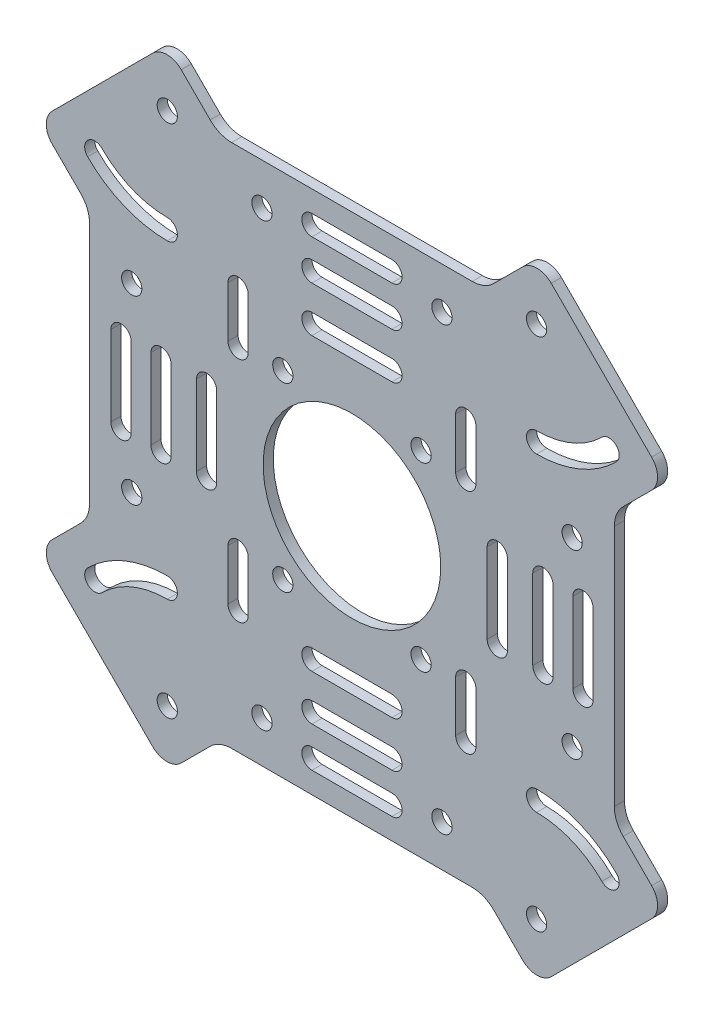
from build123d import *

# Parameters (mm, degrees)
CROQUIS1_R              = 2
CROQUIS1_R_2            = 17.550664292
SALIENTE_EXTRUIR1_DEPTH = 2


with BuildPart() as part:
    # Croquis1 → Saliente-Extruir1 (new body)
    with BuildSketch(Plane.XY):
        with BuildLine():
            Line((3840.792774936, 1034.197893978), (3840.792774936, 1058.17592135))
            ThreePointArc((3840.792774936, 1058.17592135), (3841.249497741, 1060.472021944), (3842.550134249, 1062.418562037))
            Line((3842.550134249, 1062.418562037), (3848.170692747, 1068.039120535))
            ThreePointArc((3848.170692747, 1068.039120535), (3849.342265622, 1070.867547659), (3848.170692747, 1073.695974784))
            Line((3848.170692747, 1073.695974784), (3828.337191902, 1093.529475628))
            ThreePointArc((3828.337191902, 1093.529475628), (3825.508764778, 1094.701048503), (3822.680337653, 1093.529475628))
            Line((3822.680337653, 1093.529475628), (3816.956115316, 1087.805253291))
            ThreePointArc((3816.956115316, 1087.805253291), (3815.009575223, 1086.504616783), (3812.713474628, 1086.047893978))
            Line((3812.713474628, 1086.047893978), (3788.942774936, 1086.047893978))
            Line((3788.942774936, 1086.047893978), (3765.172075243, 1086.047893978))
            ThreePointArc((3765.172075243, 1086.047893978), (3762.875974649, 1086.504616783), (3760.929434556, 1087.805253291))
            Line((3760.929434556, 1087.805253291), (3755.205212219, 1093.529475628))
            ThreePointArc((3755.205212219, 1093.529475628), (3752.376785094, 1094.701048503), (3749.548357969, 1093.529475628))
            Line((3749.548357969, 1093.529475628), (3729.714857125, 1073.695974784))
            ThreePointArc((3729.714857125, 1073.695974784), (3728.54328425, 1070.867547659), (3729.714857125, 1068.039120535))
            Line((3729.714857125, 1068.039120535), (3735.335415623, 1062.418562037))
            ThreePointArc((3735.335415623, 1062.418562037), (3736.636052131, 1060.472021944), (3737.092774936, 1058.17592135))
            Line((3737.092774936, 1058.17592135), (3737.092774936, 1034.197893978))
            Line((3737.092774936, 1034.197893978), (3737.092774936, 1010.219866606))
            ThreePointArc((3737.092774936, 1010.219866606), (3736.636052131, 1007.923766012), (3735.335415623, 1005.977225919))
            Line((3735.335415623, 1005.977225919), (3729.714857125, 1000.356667421))
            ThreePointArc((3729.714857125, 1000.356667421), (3728.54328425, 997.528240297), (3729.714857125, 994.699813172))
            Line((3729.714857125, 994.699813172), (3749.548357969, 974.866312328))
            ThreePointArc((3749.548357969, 974.866312328), (3752.376785094, 973.694739453), (3755.205212219, 974.866312328))
            Line((3755.205212219, 974.866312328), (3760.929434556, 980.590534665))
            ThreePointArc((3760.929434556, 980.590534665), (3762.875974649, 981.891171173), (3765.172075243, 982.347893978))
            Line((3765.172075243, 982.347893978), (3788.942774936, 982.347893978))
            Line((3788.942774936, 982.347893978), (3812.713474628, 982.347893978))
            ThreePointArc((3812.713474628, 982.347893978), (3815.009575223, 981.891171173), (3816.956115316, 980.590534665))
            Line((3816.956115316, 980.590534665), (3822.680337653, 974.866312328))
            ThreePointArc((3822.680337653, 974.866312328), (3825.508764778, 973.694739453), (3828.337191902, 974.866312328))
            Line((3828.337191902, 974.866312328), (3848.170692747, 994.699813172))
            ThreePointArc((3848.170692747, 994.699813172), (3849.342265622, 997.528240297), (3848.170692747, 1000.356667421))
            Line((3848.170692747, 1000.356667421), (3842.550134249, 1005.977225919))
            ThreePointArc((3842.550134249, 1005.977225919), (3841.249497741, 1007.923766012), (3840.792774936, 1010.219866606))
            Line((3840.792774936, 1010.219866606), (3840.792774936, 1034.197893978))
        make_face()
        with Locations((3825.435609484, 1085.117349548)):
            Circle(CROQUIS1_R, mode=Mode.SUBTRACT)
        with Locations((3771.158067563, 1077.82024622)):
            Circle(CROQUIS1_R, mode=Mode.SUBTRACT)
        with Locations((3752.449940388, 1085.117349548)):
            Circle(CROQUIS1_R, mode=Mode.SUBTRACT)
        with Locations((3825.435609484, 983.278438408)):
            Circle(CROQUIS1_R, mode=Mode.SUBTRACT)
        with Locations((3752.449940388, 983.278438408)):
            Circle(CROQUIS1_R, mode=Mode.SUBTRACT)
        with Locations((3806.727482309, 1077.82024622)):
            Circle(CROQUIS1_R, mode=Mode.SUBTRACT)
        with Locations((3771.158067563, 990.575541736)):
            Circle(CROQUIS1_R, mode=Mode.SUBTRACT)
        with Locations((3806.727482309, 990.575541736)):
            Circle(CROQUIS1_R, mode=Mode.SUBTRACT)
        with Locations((3745.424086533, 1052.086265191)):
            Circle(CROQUIS1_R, mode=Mode.SUBTRACT)
        with Locations((3832.461463339, 1052.086265191)):
            Circle(CROQUIS1_R, mode=Mode.SUBTRACT)
        with Locations((3745.424086533, 1016.309522765)):
            Circle(CROQUIS1_R, mode=Mode.SUBTRACT)
        with Locations((3832.461463339, 1016.309522765)):
            Circle(CROQUIS1_R, mode=Mode.SUBTRACT)
        with Locations((3788.942774936, 1034.028366495)):
            Circle(CROQUIS1_R_2, mode=Mode.SUBTRACT)
        with Locations((3775.282861576, 1052.086265191)):
            Circle(CROQUIS1_R, mode=Mode.SUBTRACT)
        with Locations((3802.602688295, 1052.086265191)):
            Circle(CROQUIS1_R, mode=Mode.SUBTRACT)
        with Locations((3775.282861576, 1016.309522765)):
            Circle(CROQUIS1_R, mode=Mode.SUBTRACT)
        with Locations((3802.602688295, 1016.309522765)):
            Circle(CROQUIS1_R, mode=Mode.SUBTRACT)
        with BuildLine():
            Line((3809.442774936, 1051.697893978), (3809.442774936, 1061.697893978))
            ThreePointArc((3809.442774936, 1061.697893978), (3811.442774936, 1063.697893978), (3813.442774936, 1061.697893978))
            Line((3813.442774936, 1061.697893978), (3813.442774936, 1051.697893978))
            ThreePointArc((3813.442774936, 1051.697893978), (3811.442774936, 1049.697893978), (3809.442774936, 1051.697893978))
        make_face(mode=Mode.SUBTRACT)
        with BuildLine():
            Line((3764.442774936, 1051.697893978), (3764.442774936, 1061.697893978))
            ThreePointArc((3764.442774936, 1061.697893978), (3766.442774936, 1063.697893978), (3768.442774936, 1061.697893978))
            Line((3768.442774936, 1061.697893978), (3768.442774936, 1051.697893978))
            ThreePointArc((3768.442774936, 1051.697893978), (3766.442774936, 1049.697893978), (3764.442774936, 1051.697893978))
        make_face(mode=Mode.SUBTRACT)
        with BuildLine():
            Line((3764.442774936, 1006.697893978), (3764.442774936, 1016.697893978))
            ThreePointArc((3764.442774936, 1016.697893978), (3766.442774936, 1018.697893978), (3768.442774936, 1016.697893978))
            Line((3768.442774936, 1016.697893978), (3768.442774936, 1006.697893978))
            ThreePointArc((3768.442774936, 1006.697893978), (3766.442774936, 1004.697893978), (3764.442774936, 1006.697893978))
        make_face(mode=Mode.SUBTRACT)
        with BuildLine():
            Line((3809.442774936, 1006.697893978), (3809.442774936, 1016.697893978))
            ThreePointArc((3809.442774936, 1016.697893978), (3811.442774936, 1018.697893978), (3813.442774936, 1016.697893978))
            Line((3813.442774936, 1016.697893978), (3813.442774936, 1006.697893978))
            ThreePointArc((3813.442774936, 1006.697893978), (3811.442774936, 1004.697893978), (3809.442774936, 1006.697893978))
        make_face(mode=Mode.SUBTRACT)
        with BuildLine():
            Line((3832.59149284, 1026.291938739), (3832.59149284, 1042.103849217))
            ThreePointArc((3832.59149284, 1042.103849217), (3834.59149284, 1044.103849217), (3836.59149284, 1042.103849217))
            Line((3836.59149284, 1042.103849217), (3836.59149284, 1026.291938739))
            ThreePointArc((3836.59149284, 1026.291938739), (3834.59149284, 1024.291938739), (3832.59149284, 1026.291938739))
        make_face(mode=Mode.SUBTRACT)
        with BuildLine():
            Line((3824.674318657, 1026.291938739), (3824.674318657, 1042.103849217))
            ThreePointArc((3824.674318657, 1042.103849217), (3826.674318657, 1044.103849217), (3828.674318657, 1042.103849217))
            Line((3828.674318657, 1042.103849217), (3828.674318657, 1026.291938739))
            ThreePointArc((3828.674318657, 1026.291938739), (3826.674318657, 1024.291938739), (3824.674318657, 1026.291938739))
        make_face(mode=Mode.SUBTRACT)
        with BuildLine():
            Line((3815.670465882, 1026.291938739), (3815.670465882, 1042.103849217))
            ThreePointArc((3815.670465882, 1042.103849217), (3817.670465882, 1044.103849217), (3819.670465882, 1042.103849217))
            Line((3819.670465882, 1042.103849217), (3819.670465882, 1026.291938739))
            ThreePointArc((3819.670465882, 1026.291938739), (3817.670465882, 1024.291938739), (3815.670465882, 1026.291938739))
        make_face(mode=Mode.SUBTRACT)
        with BuildLine():
            Line((3796.848730175, 1077.846611882), (3781.036819696, 1077.846611882))
            ThreePointArc((3781.036819696, 1077.846611882), (3779.036819696, 1079.846611882), (3781.036819696, 1081.846611882))
            Line((3781.036819696, 1081.846611882), (3796.848730175, 1081.846611882))
            ThreePointArc((3796.848730175, 1081.846611882), (3798.848730175, 1079.846611882), (3796.848730175, 1077.846611882))
        make_face(mode=Mode.SUBTRACT)
        with BuildLine():
            Line((3796.848730175, 1069.929437699), (3781.036819696, 1069.929437699))
            ThreePointArc((3781.036819696, 1069.929437699), (3779.036819696, 1071.929437699), (3781.036819696, 1073.929437699))
            Line((3781.036819696, 1073.929437699), (3796.848730175, 1073.929437699))
            ThreePointArc((3796.848730175, 1073.929437699), (3798.848730175, 1071.929437699), (3796.848730175, 1069.929437699))
        make_face(mode=Mode.SUBTRACT)
        with BuildLine():
            Line((3796.848730175, 1060.925584924), (3781.036819696, 1060.925584924))
            ThreePointArc((3781.036819696, 1060.925584924), (3779.036819696, 1062.925584924), (3781.036819696, 1064.925584924))
            Line((3781.036819696, 1064.925584924), (3796.848730175, 1064.925584924))
            ThreePointArc((3796.848730175, 1064.925584924), (3798.848730175, 1062.925584924), (3796.848730175, 1060.925584924))
        make_face(mode=Mode.SUBTRACT)
        with BuildLine():
            Line((3745.294057032, 1042.103849217), (3745.294057032, 1026.291938739))
            ThreePointArc((3745.294057032, 1026.291938739), (3743.294057032, 1024.291938739), (3741.294057032, 1026.291938739))
            Line((3741.294057032, 1026.291938739), (3741.294057032, 1042.103849217))
            ThreePointArc((3741.294057032, 1042.103849217), (3743.294057032, 1044.103849217), (3745.294057032, 1042.103849217))
        make_face(mode=Mode.SUBTRACT)
        with BuildLine():
            Line((3753.211231215, 1042.103849217), (3753.211231215, 1026.291938739))
            ThreePointArc((3753.211231215, 1026.291938739), (3751.211231215, 1024.291938739), (3749.211231215, 1026.291938739))
            Line((3749.211231215, 1026.291938739), (3749.211231215, 1042.103849217))
            ThreePointArc((3749.211231215, 1042.103849217), (3751.211231215, 1044.103849217), (3753.211231215, 1042.103849217))
        make_face(mode=Mode.SUBTRACT)
        with BuildLine():
            Line((3762.215083989, 1042.103849217), (3762.215083989, 1026.291938739))
            ThreePointArc((3762.215083989, 1026.291938739), (3760.215083989, 1024.291938739), (3758.215083989, 1026.291938739))
            Line((3758.215083989, 1026.291938739), (3758.215083989, 1042.103849217))
            ThreePointArc((3758.215083989, 1042.103849217), (3760.215083989, 1044.103849217), (3762.215083989, 1042.103849217))
        make_face(mode=Mode.SUBTRACT)
        with BuildLine():
            Line((3781.036819696, 990.549176074), (3796.848730175, 990.549176074))
            ThreePointArc((3796.848730175, 990.549176074), (3798.848730175, 988.549176074), (3796.848730175, 986.549176074))
            Line((3796.848730175, 986.549176074), (3781.036819696, 986.549176074))
            ThreePointArc((3781.036819696, 986.549176074), (3779.036819696, 988.549176074), (3781.036819696, 990.549176074))
        make_face(mode=Mode.SUBTRACT)
        with BuildLine():
            Line((3781.036819696, 998.466350257), (3796.848730175, 998.466350257))
            ThreePointArc((3796.848730175, 998.466350257), (3798.848730175, 996.466350257), (3796.848730175, 994.466350257))
            Line((3796.848730175, 994.466350257), (3781.036819696, 994.466350257))
            ThreePointArc((3781.036819696, 994.466350257), (3779.036819696, 996.466350257), (3781.036819696, 998.466350257))
        make_face(mode=Mode.SUBTRACT)
        with BuildLine():
            Line((3781.036819696, 1007.470203032), (3796.848730175, 1007.470203032))
            ThreePointArc((3796.848730175, 1007.470203032), (3798.848730175, 1005.470203032), (3796.848730175, 1003.470203032))
            Line((3796.848730175, 1003.470203032), (3781.036819696, 1003.470203032))
            ThreePointArc((3781.036819696, 1003.470203032), (3779.036819696, 1005.470203032), (3781.036819696, 1007.470203032))
        make_face(mode=Mode.SUBTRACT)
        with BuildLine():
            ThreePointArc((3841.172780228, 1069.380178803), (3841.172780228, 1072.208605928), (3838.344353103, 1072.208605928))
            ThreePointArc((3838.344353103, 1072.208605928), (3832.421771189, 1068.251263211), (3825.435609484, 1066.861629248))
            ThreePointArc((3825.435609484, 1066.861629248), (3823.435609484, 1064.861629248), (3825.435609484, 1062.861629248))
            ThreePointArc((3825.435609484, 1062.861629248), (3833.952504918, 1064.555745081), (3841.172780228, 1069.380178803))
        make_face(mode=Mode.SUBTRACT)
        with BuildLine():
            ThreePointArc((3739.541196768, 1072.208605928), (3736.712769644, 1072.208605928), (3736.712769644, 1069.380178803))
            ThreePointArc((3736.712769644, 1069.380178803), (3743.933044954, 1064.555745081), (3752.449940388, 1062.861629248))
            ThreePointArc((3752.449940388, 1062.861629248), (3754.449940388, 1064.861629248), (3752.449940388, 1066.861629248))
            ThreePointArc((3752.449940388, 1066.861629248), (3745.463778683, 1068.251263211), (3739.541196768, 1072.208605928))
        make_face(mode=Mode.SUBTRACT)
        with BuildLine():
            ThreePointArc((3838.344353103, 996.187182028), (3841.172780228, 996.187182028), (3841.172780228, 999.015609153))
            ThreePointArc((3841.172780228, 999.015609153), (3833.952504918, 1003.840042875), (3825.435609484, 1005.534158708))
            ThreePointArc((3825.435609484, 1005.534158708), (3823.435609484, 1003.534158708), (3825.435609484, 1001.534158708))
            ThreePointArc((3825.435609484, 1001.534158708), (3832.421771189, 1000.144524745), (3838.344353103, 996.187182028))
        make_face(mode=Mode.SUBTRACT)
        with BuildLine():
            ThreePointArc((3736.712769644, 999.015609153), (3736.712769644, 996.187182028), (3739.541196768, 996.187182028))
            ThreePointArc((3739.541196768, 996.187182028), (3745.463778683, 1000.144524745), (3752.449940388, 1001.534158708))
            ThreePointArc((3752.449940388, 1001.534158708), (3754.449940388, 1003.534158708), (3752.449940388, 1005.534158708))
            ThreePointArc((3752.449940388, 1005.534158708), (3743.933044954, 1003.840042875), (3736.712769644, 999.015609153))
        make_face(mode=Mode.SUBTRACT)
    extrude(amount=SALIENTE_EXTRUIR1_DEPTH)


solid = part.part
